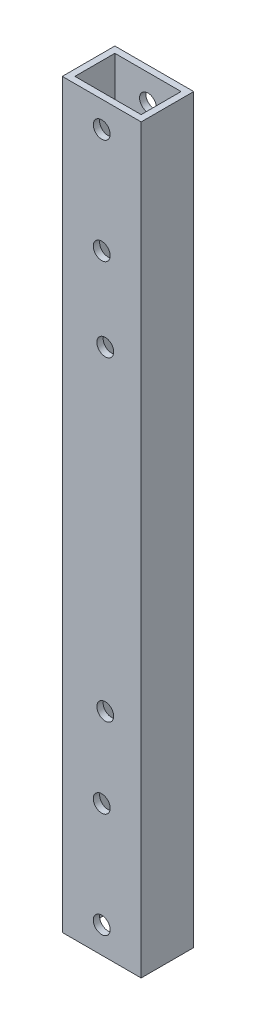
from build123d import *

# Parameters (mm, degrees)
SKETCH_1_W          = 15
SKETCH_1_H          = 10
SKETCH_1_W_2        = 12.6
SKETCH_1_H_2        = 7.6
EXTRUDE_1_DEPTH     = 70.5
SKETCH_2_R          = 1.6
CUT_EXTRUDE_1_DEPTH = 100
SKETCH_3_R          = 1.6
CUT_EXTRUDE_2_DEPTH = 10


with BuildPart() as part:
    # ｽｹｯﾁ1 → ﾎﾞｽ - 押し出し1 (new, symmetric)
    with BuildSketch(Plane(origin=(0, 0, 0), x_dir=(1, 0, 0), z_dir=(0, 1, 0))):
        Rectangle(SKETCH_1_W, SKETCH_1_H)
        Rectangle(SKETCH_1_W_2, SKETCH_1_H_2, mode=Mode.SUBTRACT)
    extrude(amount=EXTRUDE_1_DEPTH, both=True)

    # ｽｹｯﾁ2 → ｶｯﾄ - 押し出し1 (cut)
    with BuildSketch(Plane(origin=(0, 0, -5), x_dir=(-1, 0, 0), z_dir=(0, 0, -1))):
        with Locations((0, -65.5)):
            Circle(SKETCH_2_R)
        with Locations((0, -45.5)):
            Circle(SKETCH_2_R)
        with Locations(Location((0, 45.5, 0), (0, 0, 180))):
            Circle(SKETCH_2_R)
        with Locations(Location((0, 65.5, 0), (0, 0, 180))):
            Circle(SKETCH_2_R)
    extrude(amount=-CUT_EXTRUDE_1_DEPTH, mode=Mode.SUBTRACT)

    # ｽｹｯﾁ3 → ｶｯﾄ - 押し出し2 (cut)
    with BuildSketch(Plane(origin=(0, 0, -5), x_dir=(-1, 0, 0), z_dir=(0, 0, -1))):
        with Locations((-0.676513704, -30)):
            Circle(SKETCH_3_R)
        with Locations((-0.676513704, 30)):
            Circle(SKETCH_3_R)
    extrude(amount=-CUT_EXTRUDE_2_DEPTH, mode=Mode.SUBTRACT)


solid = part.part
